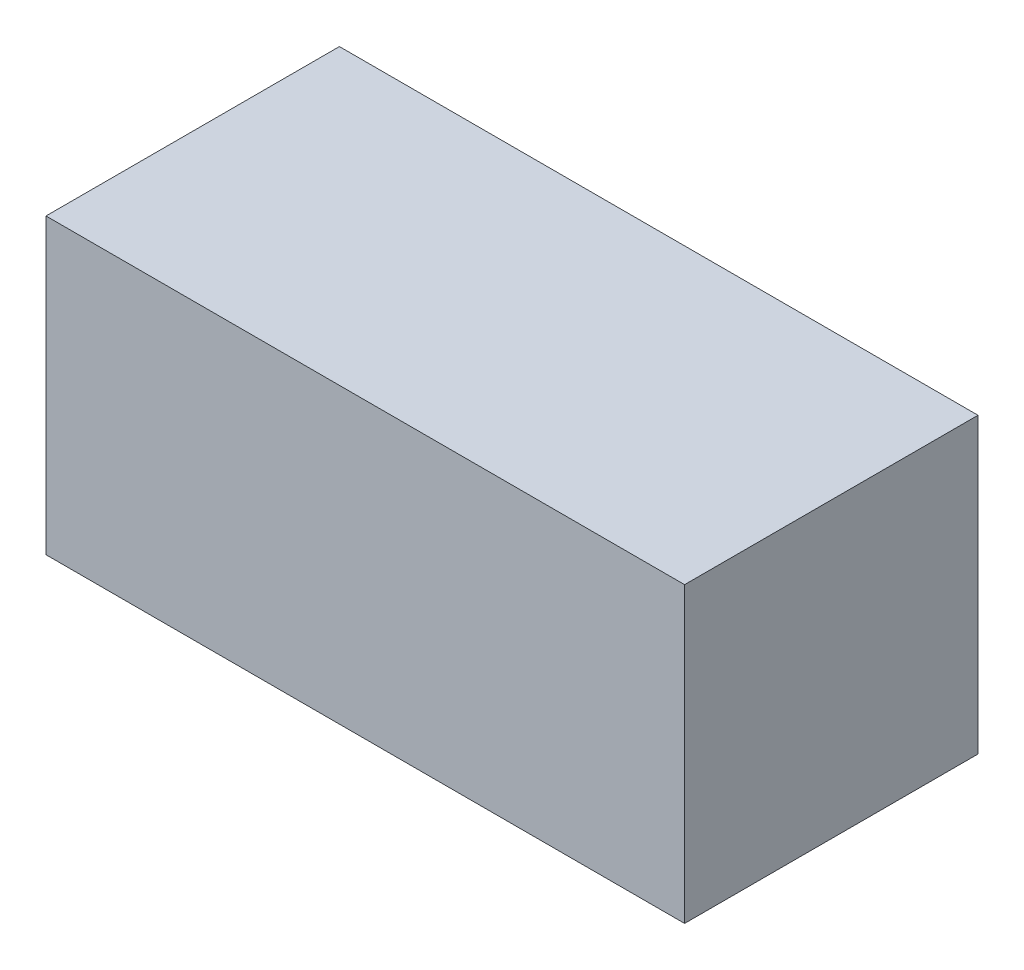
from build123d import *

# Parameters (mm, degrees)
SKETCH1_W               = 3.700018
SKETCH1_H               = 1.700022
COMPONENT_OUTLINE_DEPTH = 1.6999966


with BuildPart() as part:
    # Sketch1 → Component_Outline (new body)
    with BuildSketch(Plane.XY):
        Rectangle(SKETCH1_W, SKETCH1_H)
    extrude(amount=COMPONENT_OUTLINE_DEPTH)


solid = part.part
